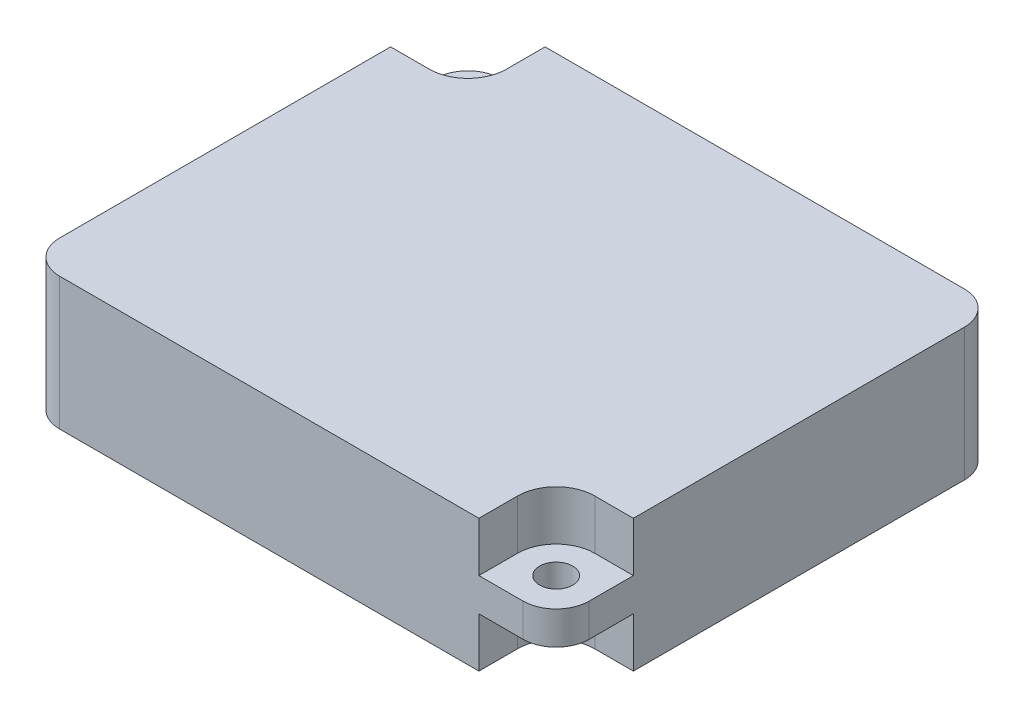
from build123d import *

# Parameters (mm, degrees)
SKETCH1_W               = 48
SKETCH1_H               = 40
BOSS_EXTRUDE1_DEPTH     = 6
CUT_EXTRUDE1_DEPTH      = 34.466401061
CUT_EXTRUDE1_DEPTH_BACK = 34.466401061
SKETCH3_R               = 1.5
BOSS_EXTRUDE2_DEPTH     = 1.5
FILLET1_R               = 3


with BuildPart() as part:
    # Sketch1 → Boss-Extrude1 (new, symmetric)
    with BuildSketch(Plane(origin=(0, 0, 0), x_dir=(1, 0, 0), z_dir=(0, 1, 0))):
        Rectangle(SKETCH1_W, SKETCH1_H)
    extrude(amount=BOSS_EXTRUDE1_DEPTH, both=True)

    # Sketch2 → Cut-Extrude1 (cut, two sides: drawn at the far end of the back side and taken through both)
    with BuildSketch(Plane(origin=(0, 6, 0), x_dir=(1, 0, 0), z_dir=(0, 1, 0)).offset(-CUT_EXTRUDE1_DEPTH_BACK)):
        with BuildLine():
            Line((-24, 13), (-20.5, 13))
            ThreePointArc((-20.5, 13), (-18.025126266, 14.025126266), (-17, 16.5))
            Line((-17, 16.5), (-17, 20))
            Line((-17, 20), (-24, 20))
            Line((-24, 20), (-24, 13))
        make_face()
        with BuildLine():
            Line((24, -13), (20.5, -13))
            ThreePointArc((20.5, -13), (18.025126266, -14.025126266), (17, -16.5))
            Line((17, -16.5), (17, -20))
            Line((17, -20), (24, -20))
            Line((24, -20), (24, -13))
        make_face()
    extrude(amount=CUT_EXTRUDE1_DEPTH + CUT_EXTRUDE1_DEPTH_BACK, mode=Mode.SUBTRACT)

    # Sketch3 → Boss-Extrude2 (add, symmetric)
    # profile 1 of 2: a face of its own
    with BuildSketch(Plane(origin=(0, 0, 0), x_dir=(1, 0, 0), z_dir=(0, 1, 0))):
        with BuildLine():
            Line((24, -13), (20.5, -13))
            ThreePointArc((20.5, -13), (18.025126266, -14.025126266), (17, -16.5))
            Line((17, -16.5), (17, -20))
            Line((17, -20), (24, -20))
            Line((24, -20), (24, -13))
        make_face()
        with Locations(Location((20.5, -16.5, 0), (0, 0, 270))):
            Circle(SKETCH3_R, mode=Mode.SUBTRACT)
    # profile 2 of 2: a face of its own
    with BuildSketch(Plane(origin=(0, 0, 0), x_dir=(1, 0, 0), z_dir=(0, 1, 0))):
        with BuildLine():
            Line((-24, 13), (-20.5, 13))
            ThreePointArc((-20.5, 13), (-18.025126266, 14.025126266), (-17, 16.5))
            Line((-17, 16.5), (-17, 20))
            Line((-17, 20), (-24, 20))
            Line((-24, 20), (-24, 13))
        make_face()
        with Locations(Location((-20.5, 16.5, 0), (0, 0, 270))):
            Circle(SKETCH3_R, mode=Mode.SUBTRACT)
    extrude(amount=BOSS_EXTRUDE2_DEPTH, both=True)

    # Fillet1
    fillet1_edges = [part.edges().sort_by_distance(p)[0] for p in [
        (24, 0, 20),
        (-24, 0, 20),
        (24, 0, -20),
        (-24, 0, -20),
    ]]
    fillet(fillet1_edges, radius=FILLET1_R)


solid = part.part
